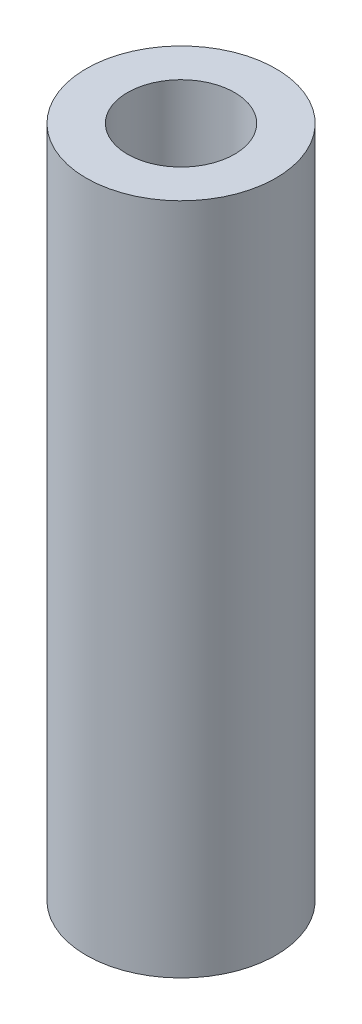
from build123d import *

# Parameters (mm, degrees)
SZKIC1_R                    = 62
SZKIC1_R_2                  = 35
DODANIE_WYCI_GNI_CIE1_DEPTH = 440


with BuildPart() as part:
    # Szkic1 → Dodanie-wyciągnięcie1 (new body)
    with BuildSketch(Plane(origin=(0, 0, 0), x_dir=(1, 0, 0), z_dir=(0, 1, 0))):
        with Locations(Location((0, 0, 0), (0, 0, 270))):
            Circle(SZKIC1_R)
        with Locations(Location((0, 0, 0), (0, 0, 270))):
            Circle(SZKIC1_R_2, mode=Mode.SUBTRACT)
    extrude(amount=DODANIE_WYCI_GNI_CIE1_DEPTH)


solid = part.part
